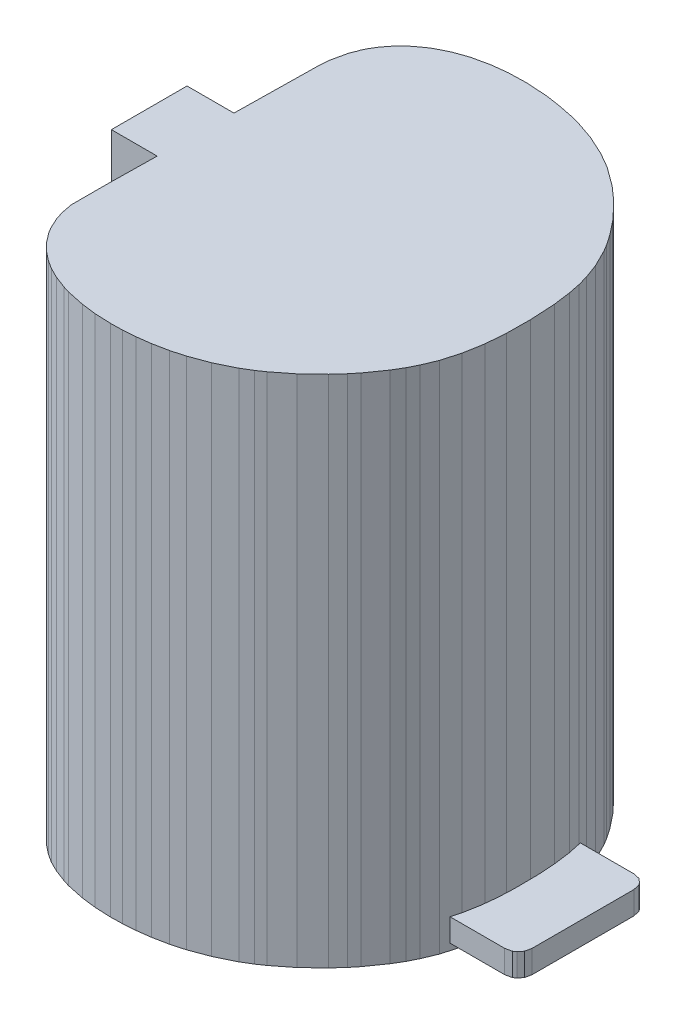
from build123d import *

# Parameters (mm, degrees)
BIN_BODY_DEPTH         = 225
SKETCH2_W              = 20.6
SKETCH2_H              = 33.1
ROD_CHANNEL_DEPTH      = 225
PEDAL_PAD_TOP_16_DEPTH = 10


with BuildPart() as part:
    # Sketch1 → Bin body (new body)
    with BuildSketch(Plane(origin=(0, 3, 0), x_dir=(1, 0, 0), z_dir=(0, 1, 0))):
        Polygon((-26.8, 97.4), (-33.6, 96.6), (-41, 95), (-47.2, 92.8), (-52.4, 90.2), (-54.3, 89), (-58.1, 86.2), (-60.4, 84.1), (-62.7, 81.6), (-64.9, 78.7), (-66.5, 76.1), (-67.8, 73.5), (-67.9, 72.9), (-69.1, 70.1), (-70.7, 62.9), (-71, 59.1), (-72.4, -33.1), (-72.4, -48.4), (-71.5, -52.9), (-70.5, -56.3), (-68.1, -61.5), (-66.7, -63.8), (-63.4, -68.1), (-60.3, -71.2), (-56.4, -74.3), (-52.7, -76.7), (-48.3, -78.9), (-42.8, -81), (-39.9, -81.9), (-32.3, -83.5), (-25.9, -84.3), (-18.9, -84.6), (-13.8, -84.5), (-8.3, -84.1), (-2.2, -83.3), (4.3, -82), (10.1, -80.4), (18.2, -77.4), (26.2, -73.5), (30.5, -70.9), (33.7, -68.7), (41.1, -62.9), (48.1, -56.2), (52.1, -51.8), (54.7, -48.6), (60, -41.1), (62.6, -36.7), (64.6, -32.7), (67.1, -26.7), (69.3, -19), (70.8, -10.5), (71.5, -1.8), (71.6, 8.7), (71, 19.8), (70, 27.3), (68.9, 32.7), (67.7, 37), (65.4, 43.3), (61.7, 50.7), (59.9, 53.7), (56.9, 58.1), (51.6, 64.8), (44.6, 72.1), (38.7, 77.3), (30.5, 83.3), (23.9, 87.1), (15.6, 90.9), (7.7, 93.6), (3.5, 94.7), (-2.9, 96), (-9.5, 97), (-19.1, 97.6), align=None)
    extrude(amount=BIN_BODY_DEPTH)

    # Sketch2 → Rod channel (add)
    with BuildSketch(Plane(origin=(0, 3, 0), x_dir=(1, 0, 0), z_dir=(0, 1, 0))):
        with Locations((-81.8, 5.55)):
            Rectangle(SKETCH2_W, SKETCH2_H)
    extrude(amount=ROD_CHANNEL_DEPTH)


with BuildPart() as body_2:
    # Sketch3 → Pedal pad (top 16) (new body)
    with BuildSketch(Plane(origin=(0, 6, 0), x_dir=(1, 0, 0), z_dir=(0, 1, 0))):
        Polygon((68.8, 33.3), (70.1, 27.3), (71.1, 19.8), (71.6, 12.1), (71.7, 1.7), (71.4, -5.3), (70.7, -12), (69.4, -19), (68.3, -23.2), (92.2, -23.2), (95, -22.6), (96.2, -21.7), (97.6, -20), (98.2, -17.2), (98.2, 27.3), (97.6, 30.1), (96.7, 31.3), (95, 32.7), (92.2, 33.3), align=None)
    extrude(amount=PEDAL_PAD_TOP_16_DEPTH)


solid = Compound([part.part, body_2.part])
